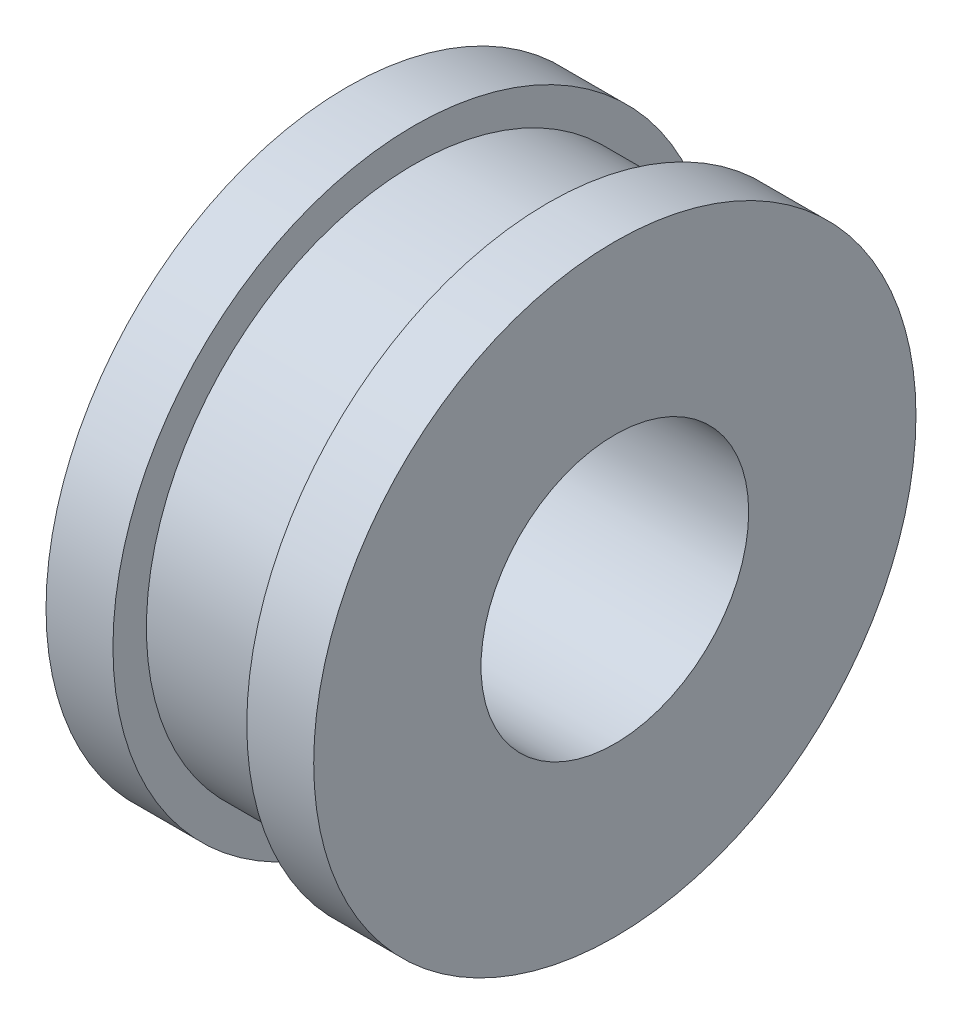
from build123d import *


with BuildPart() as part:
    # Sketch2 → Revolve1 (revolve)
    with BuildSketch(Plane.XY, mode=Mode.PRIVATE) as revolve1_sk:
        Polygon((-6, 4), (2, 4), (2, 9), (0, 9), (0, 8), (-4, 8), (-4, 9), (-6, 9), align=None)
    revolve(revolve1_sk.sketch.rotate(Axis((0, 0, 0), (-1, 0, 0)), 90), axis=Axis((0, 0, 0), (-1, 0, 0)))


solid = part.part
